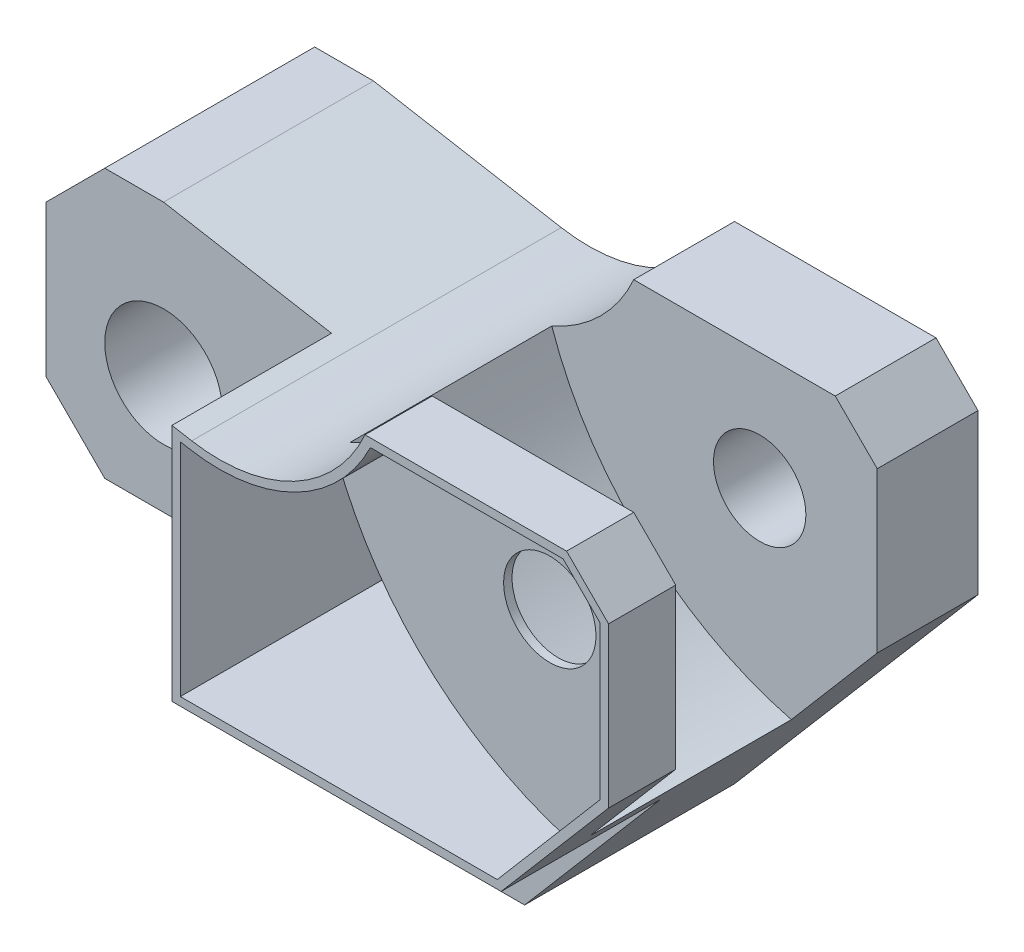
from build123d import *

# Parameters (mm, degrees)
SKETCH2_R           = 7
BOSS_EXTRUDE1_DEPTH = 44
SKETCH7_W           = 34
SKETCH7_H           = 19
CUT_EXTRUDE1_DEPTH  = 93.956979297
SKETCH8_W           = 19
SKETCH8_H           = 19
CUT_EXTRUDE2_DEPTH  = 103.08329932
SKETCH9_R           = 5.5
CUT_EXTRUDE3_DEPTH  = 91.60353194
CUT_EXTRUDE4_DEPTH  = 24
CUT_EXTRUDE6_DEPTH  = 7
CUT_EXTRUDE7_DEPTH  = 25


with BuildPart() as part:
    # Sketch2 → Boss-Extrude1 (new body)
    with BuildSketch(Plane.XY):
        with BuildLine():
            Line((-14, 11), (-7, 18))
            Line((-7, 18), (0, 18))
            Line((0, 18), (22.361380836, 14.057085233))
            ThreePointArc((22.361380836, 14.057085233), (34.561098706, 15.982044142), (43, 25))
            Line((43, 25), (67, 25))
            Line((67, 25), (72, 20))
            Line((72, 20), (72, 1))
            Line((72, 1), (43, -33))
            Line((43, -33), (37.296980053, -33))
            ThreePointArc((37.296980053, -33), (32.858007856, -26.115672061), (30.521177653, -18.264705882))
            ThreePointArc((30.521177653, -18.264705882), (28.840774692, -15.213413768), (25.575538911, -14))
            Line((25.575538911, -14), (-7, -14))
            Line((-7, -14), (-14, -7))
            Line((-14, -7), (-14, 11))
        make_face()
        Circle(SKETCH2_R, mode=Mode.SUBTRACT)
    extrude(amount=BOSS_EXTRUDE1_DEPTH)

    # Sketch7 → Cut-Extrude1 (cut, through all)
    with BuildSketch(Plane(origin=(0, -14, 0), x_dir=(-1, 0, 0), z_dir=(0, -1, 0))):
        with Locations((-3, -34.5)):
            Rectangle(SKETCH7_W, SKETCH7_H)
    extrude(amount=-CUT_EXTRUDE1_DEPTH, mode=Mode.SUBTRACT)

    # Sketch8 → Cut-Extrude2 (cut, through all)
    with BuildSketch(Plane(origin=(72, 0, 0), x_dir=(0, 0, -1), z_dir=(1, 0, 0))):
        with Locations((-34.5, -23.5)):
            Rectangle(SKETCH8_W, SKETCH8_H)
    extrude(amount=-CUT_EXTRUDE2_DEPTH, mode=Mode.SUBTRACT)

    # Sketch9 → Cut-Extrude3 (cut, through all)
    with BuildSketch(Plane.XY.offset(44)):
        with Locations((58, 11)):
            Circle(SKETCH9_R)
    extrude(amount=-CUT_EXTRUDE3_DEPTH, mode=Mode.SUBTRACT)

    # Sketch11 → Cut-Extrude4 (cut)
    with BuildSketch(Plane(origin=(0, 0, 12), x_dir=(-1, 0, 0), z_dir=(0, 0, -1))):
        with BuildLine():
            Line((-61.764705882, -11), (-72, 1))
            Line((-72, 1), (-72, 20))
            Line((-72, 20), (-67, 25))
            Line((-67, 25), (-43, 25))
            ThreePointArc((-43, 25), (-39.021244343, 19.259333621), (-33.236936549, 15.344294617))
            ThreePointArc((-33.236936549, 15.344294617), (-44.184262982, -1.419294771), (-61.764705882, -11))
        make_face()
    extrude(amount=-CUT_EXTRUDE4_DEPTH, mode=Mode.SUBTRACT)

    # Sketch15 → Cut-Extrude6 (cut)
    with BuildSketch(Plane.XY.offset(44)):
        with BuildLine():
            Line((21, -13), (58.744476296, -13))
            Line((58.744476296, -13), (71, 1.368545033))
            Line((71, 1.368545033), (71, 19.585786438))
            Line((71, 19.585786438), (66.585786438, 24))
            Line((66.585786438, 24), (43.636084685, 24))
            ThreePointArc((43.636084685, 24), (34.740005768, 14.948047079), (22.187732658, 13.07227748))
            Line((22.187732658, 13.07227748), (21, 13.281706793))
            Line((21, 13.281706793), (21, -13))
        make_face()
    extrude(amount=-CUT_EXTRUDE6_DEPTH, mode=Mode.SUBTRACT)

    # Sketch20 → Cut-Extrude7 (cut)
    with BuildSketch(Plane.XY.offset(37)):
        with BuildLine():
            Line((22.187732658, 13.07227748), (21, 13.281706793))
            Line((21, 13.281706793), (21, -13))
            Line((21, -13), (58.744476296, -13))
            Line((58.744476296, -13), (59.986847747, -11.543426575))
            ThreePointArc((59.986847747, -11.543426575), (43.310181683, -1.972127362), (32.646682943, 14.028208705))
            ThreePointArc((32.646682943, 14.028208705), (27.481076416, 12.851449437), (22.187732658, 13.07227748))
        make_face()
    extrude(amount=-CUT_EXTRUDE7_DEPTH, mode=Mode.SUBTRACT)


solid = part.part
